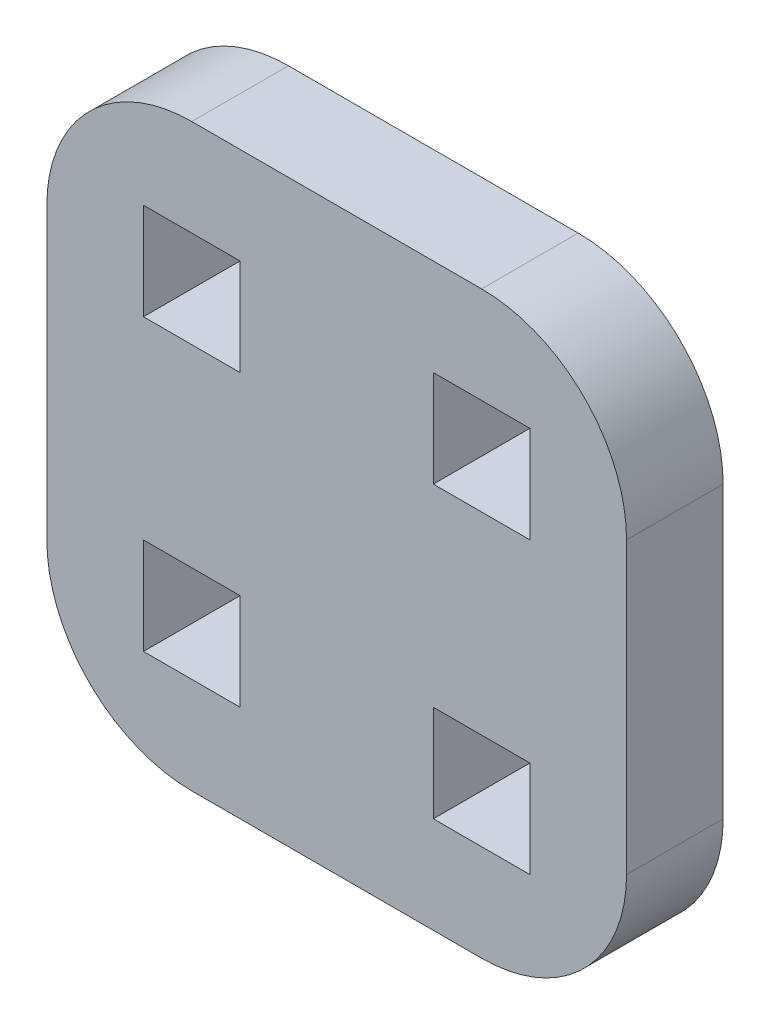
from build123d import *

# Parameters (mm, degrees)
MODEL_W                 = 3
MODEL_H                 = 3
SALIENTE_EXTRUIR1_DEPTH = 3


with BuildPart() as part:
    # Model → Saliente-Extruir1 (new body)
    with BuildSketch(Plane.XY):
        with BuildLine():
            Line((9.821574141, 299.540447034), (18.821574141, 299.540447034))
            ThreePointArc((18.821574141, 299.540447034), (22.003554656, 298.222427549), (23.321574141, 295.040447034))
            Line((23.321574141, 295.040447034), (23.321574141, 286.040447034))
            ThreePointArc((23.321574141, 286.040447034), (22.003554656, 282.858466518), (18.821574141, 281.540447034))
            Line((18.821574141, 281.540447034), (9.821574141, 281.540447034))
            ThreePointArc((9.821574141, 281.540447034), (6.639593626, 282.858466518), (5.321574141, 286.040447034))
            Line((5.321574141, 286.040447034), (5.321574141, 295.040447034))
            ThreePointArc((5.321574141, 295.040447034), (6.639593626, 298.222427549), (9.821574141, 299.540447034))
        make_face()
        with Locations((9.821574141, 295.040447034)):
            Rectangle(MODEL_W, MODEL_H, mode=Mode.SUBTRACT)
        with Locations((18.821574141, 295.040447034)):
            Rectangle(MODEL_W, MODEL_H, mode=Mode.SUBTRACT)
        with Locations((9.821574141, 286.040447034)):
            Rectangle(MODEL_W, MODEL_H, mode=Mode.SUBTRACT)
        with Locations((18.821574141, 286.040447034)):
            Rectangle(MODEL_W, MODEL_H, mode=Mode.SUBTRACT)
    extrude(amount=SALIENTE_EXTRUIR1_DEPTH)


solid = part.part
